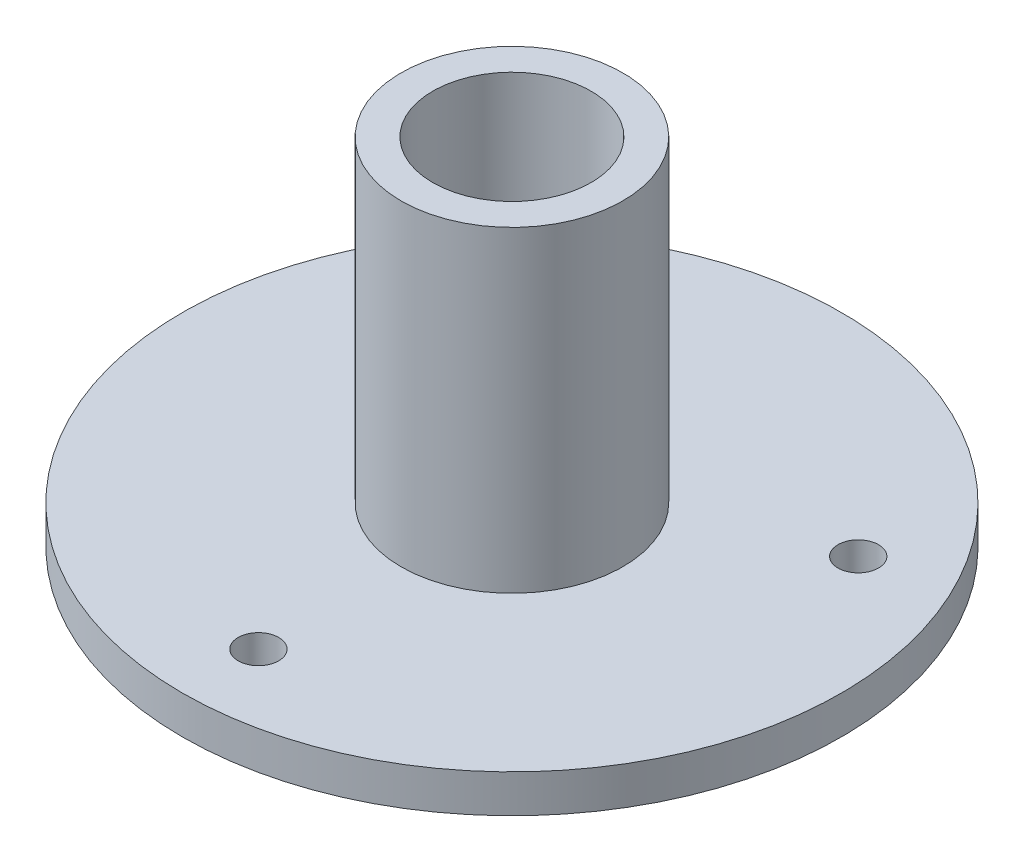
from build123d import *

# Parameters (mm, degrees)
SKETCH_1_R          = 26
EXTRUDE_1_DEPTH     = 3
SKETCH_2_R          = 8.75
EXTRUDE_2_DEPTH     = 25
SKETCH_3_R          = 6.25
CUT_EXTRUDE_1_DEPTH = 28
SKETCH_5_R          = 1.6
CUT_EXTRUDE_3_DEPTH = 3


with BuildPart() as part:
    # 草图1 → 凸台-拉伸1 (new body)
    with BuildSketch(Plane(origin=(0, 0, 0), x_dir=(1, 0, 0), z_dir=(0, 1, 0))):
        with Locations(Location((0, 0, 0), (0, 0, 270))):
            Circle(SKETCH_1_R)
    extrude(amount=EXTRUDE_1_DEPTH)

    # 草图2 → 凸台-拉伸2 (add)
    with BuildSketch(Plane(origin=(0, 3, 0), x_dir=(1, 0, 0), z_dir=(0, 1, 0))):
        with Locations(Location((0, 0, 0), (0, 0, 270))):
            Circle(SKETCH_2_R)
    extrude(amount=EXTRUDE_2_DEPTH)

    # 草图3 → 切除-拉伸1 (cut)
    with BuildSketch(Plane(origin=(0, 28, 0), x_dir=(1, 0, 0), z_dir=(0, 1, 0))):
        with Locations(Location((0, 0, 0), (0, 0, 270))):
            Circle(SKETCH_3_R)
    extrude(amount=-CUT_EXTRUDE_1_DEPTH, mode=Mode.SUBTRACT)

    # 草图5 → 切除-拉伸3 (cut)
    with BuildSketch(Plane.XZ):
        with Locations(Location((0, 20, 0), (0, 0, 270))):
            Circle(SKETCH_5_R)
        with Locations(Location((17.320508076, -10, 0), (0, 0, 270))):
            Circle(SKETCH_5_R)
        with Locations(Location((-17.320508076, -10, 0), (0, 0, 270))):
            Circle(SKETCH_5_R)
    extrude(amount=-CUT_EXTRUDE_3_DEPTH, mode=Mode.SUBTRACT)


solid = part.part
